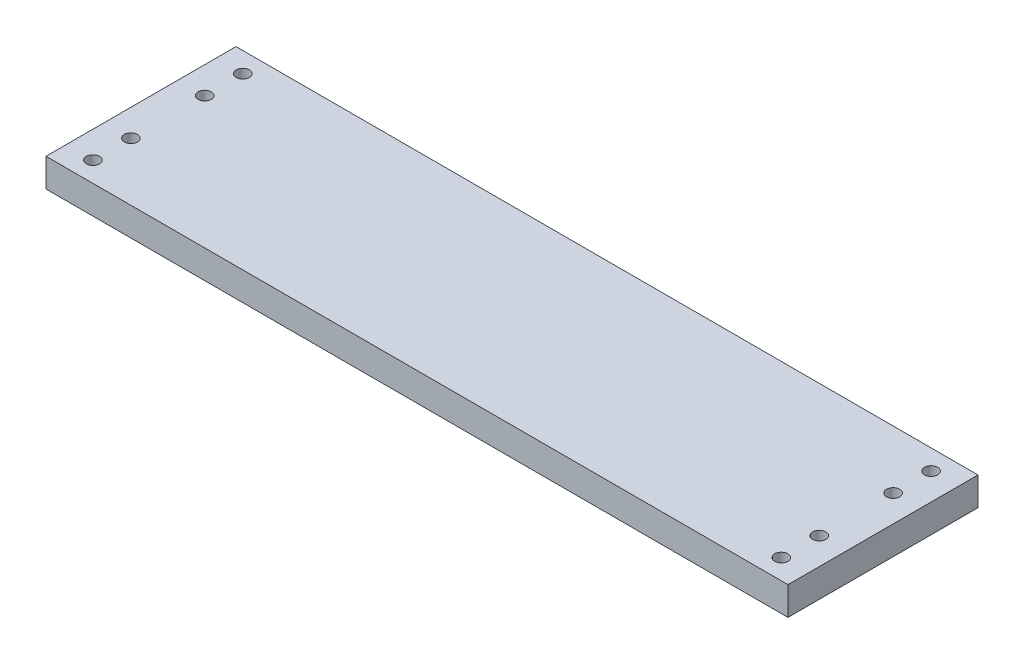
from build123d import *

# Parameters (mm, degrees)
SKETCH1_W                                         = 166
SKETCH1_H                                         = 42.51
BOSS_EXTRUDE1_DEPTH                               = 6.35
F_4_CLEARANCE_HOLE1_D                             = 2.9464
CSK_FOR_4_FLAT_HEAD_SOCKET_CAP_SCREW1_D           = 2.9464
CSK_FOR_4_FLAT_HEAD_SOCKET_CAP_SCREW1_CSINK_D     = 6.9116702
CSK_FOR_4_FLAT_HEAD_SOCKET_CAP_SCREW1_CSINK_ANGLE = 82


with BuildPart() as part:
    # Sketch1 → Boss-Extrude1 (new body)
    with BuildSketch(Plane(origin=(0, 0, 0), x_dir=(1, 0, 0), z_dir=(0, 1, 0))):
        Rectangle(SKETCH1_W, SKETCH1_H)
    extrude(amount=BOSS_EXTRUDE1_DEPTH)

    # #4 Clearance Hole1 (through all)
    with Locations(Plane(origin=(0, 6.35, 0), x_dir=(1, 0, 0), z_dir=(0, 1, 0))):
        with Locations((-77, 8.255), (-77, 16.755), (77, 8.255), (77, 16.755)):
            Hole(F_4_CLEARANCE_HOLE1_D / 2)

    # CSK for #4 Flat Head Socket Cap Screw1 (through all)
    with Locations(Plane(origin=(0, 0, 0), x_dir=(-1, 0, 0), z_dir=(0, -1, 0))):
        with Locations((77, 8.255), (77, 16.755), (-77, 8.255), (-77, 16.755)):
            csk_for_4_flat_head_socket_cap_screw1 = CounterSinkHole(CSK_FOR_4_FLAT_HEAD_SOCKET_CAP_SCREW1_D / 2, CSK_FOR_4_FLAT_HEAD_SOCKET_CAP_SCREW1_CSINK_D / 2, counter_sink_angle=CSK_FOR_4_FLAT_HEAD_SOCKET_CAP_SCREW1_CSINK_ANGLE)

    # Mirror1: CSK for #4 Flat Head Socket Cap Screw1 across plane
    add(csk_for_4_flat_head_socket_cap_screw1.mirror(Plane.XY), mode=Mode.SUBTRACT)


solid = part.part
